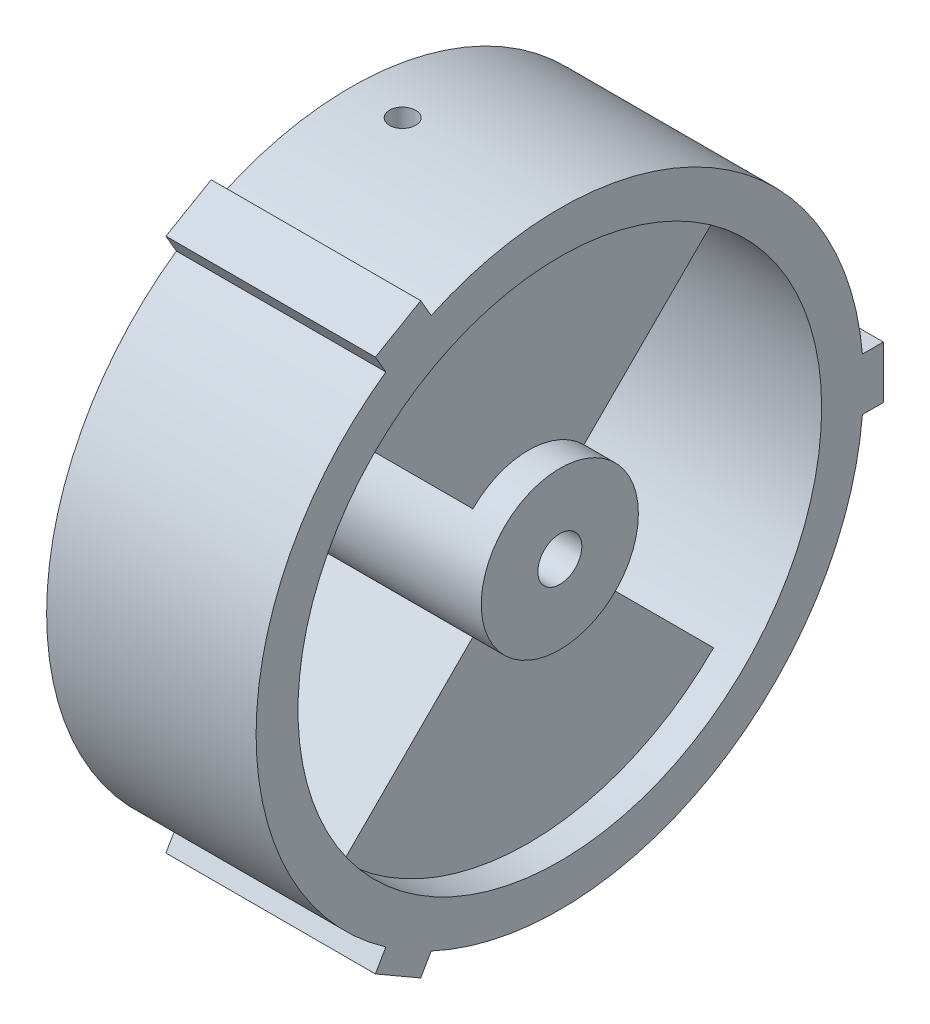
from build123d import *

# Parameters (mm, degrees)
CROQUIS2_R              = 25
CROQUIS2_R_2            = 7.5
CORTAR_EXTRUIR1_DEPTH   = 3
CORTAR_EXTRUIR3_DEPTH   = 73
CROQUIS4_R              = 1.25
CORTAR_EXTRUIR4_DEPTH   = 20
CROQUIS5_R              = 1
CORTAR_EXTRUIR5_DEPTH   = 10
CORTAR_EXTRUIR6_START   = -1
CROQUIS6_R              = 24
CROQUIS6_R_2            = 7.5
CORTAR_EXTRUIR6_DEPTH   = 1
SALIENTE_EXTRUIR1_START = -20
SALIENTE_EXTRUIR1_DEPTH = 20
MATRIZC1_COUNT          = 3


with BuildPart() as part:
    # Croquis1 → Revolución1 (revolve)
    with BuildSketch(Plane.XY, mode=Mode.PRIVATE) as revoluci_n1_sk:
        Polygon((-10, 29), (-10, 2.1), (0, 2.1), (10, 2.1), (10, 29), align=None)
    revolve(revoluci_n1_sk.sketch.rotate(Axis((0, 0, 0), (1, 0, 0)), 90), axis=Axis((0, 0, 0), (1, 0, 0)))

    # Croquis2 → Cortar-Extruir1 (cut)
    with BuildSketch(Plane(origin=(10, 0, 0), x_dir=(0, 0, -1), z_dir=(1, 0, 0))):
        Circle(CROQUIS2_R)
        Circle(CROQUIS2_R_2, mode=Mode.SUBTRACT)
    extrude(amount=-CORTAR_EXTRUIR1_DEPTH, mode=Mode.SUBTRACT)

    # Croquis3 → Cortar-Extruir3 (cut)
    with BuildSketch(Plane(origin=(10, 0, 0), x_dir=(0, 0, -1), z_dir=(1, 0, 0))):
        with BuildLine():
            ThreePointArc((-5.303301, -5.303301), (-7.5, 0), (-5.303301, 5.303301))
            Line((-5.303301, 5.303301), (-17.67767, 17.67767))
            ThreePointArc((-17.67767, 17.67767), (-25, 0), (-17.67767, -17.67767))
            Line((-17.67767, -17.67767), (-5.303301, -5.303301))
        make_face()
        with BuildLine():
            ThreePointArc((17.67767, -17.67767), (25, 0), (17.67767, 17.67767))
            Line((17.67767, 17.67767), (5.303301, 5.303301))
            ThreePointArc((5.303301, 5.303301), (7.5, 0), (5.303301, -5.303301))
            Line((5.303301, -5.303301), (17.67767, -17.67767))
        make_face()
    extrude(amount=-CORTAR_EXTRUIR3_DEPTH, mode=Mode.SUBTRACT)

    # Croquis4 → Cortar-Extruir4 (cut)
    with BuildSketch(Plane(origin=(0, 30, 0), x_dir=(1, 0, 0), z_dir=(0, 1, 0))):
        with Locations(Location((-5, 0, 0), (0, 0, 270))):
            Circle(CROQUIS4_R)
    extrude(amount=-CORTAR_EXTRUIR4_DEPTH, mode=Mode.SUBTRACT)

    # Croquis5 → Cortar-Extruir5 (cut)
    with BuildSketch(Plane(origin=(0, 10, 0), x_dir=(1, 0, 0), z_dir=(0, 1, 0))):
        with Locations(Location((-5, 0, 0), (0, 0, 270))):
            Circle(CROQUIS5_R)
    extrude(amount=-CORTAR_EXTRUIR5_DEPTH, mode=Mode.SUBTRACT)

    # Croquis6 → Cortar-Extruir6 (cut)
    with BuildSketch(Plane.ZY.offset(10).offset(CORTAR_EXTRUIR6_START)):
        Circle(CROQUIS6_R)
        with Locations(Location((0, 0, 0), (0, 0, 180))):
            Circle(CROQUIS6_R_2, mode=Mode.SUBTRACT)
    extrude(amount=CORTAR_EXTRUIR6_DEPTH, mode=Mode.SUBTRACT)

    # Croquis7 → Saliente-Extruir1 (add)
    with BuildSketch(Plane(origin=(10, 0, 0), x_dir=(0, 0, -1), z_dir=(1, 0, 0)).offset(SALIENTE_EXTRUIR1_START)):
        with BuildLine():
            Line((29, -2.5), (29, 0))
            ThreePointArc((29, 0), (28.972998, -1.251165), (28.89204, -2.5))
            Line((28.89204, -2.5), (29, -2.5))
        make_face()
        Polygon((30.89204, 2.5), (29, 2.5), (29, 0), (29, -2.5), (30.89204, -2.5), align=None)
        with BuildLine():
            Line((29, 0), (29, 2.5))
            Line((29, 2.5), (28.89204, 2.5))
            ThreePointArc((28.89204, 2.5), (28.972998, 1.251165), (29, 0))
        make_face()
    saliente_extruir1 = extrude(amount=SALIENTE_EXTRUIR1_DEPTH)

    # MatrizC1: Saliente-Extruir1 ×3 about axis
    matrizc1_axis = Axis((0, 0, 0), (1, 0, 0))
    for i in range(1, MATRIZC1_COUNT):
        add(saliente_extruir1.rotate(matrizc1_axis, i * 360 / MATRIZC1_COUNT))


solid = part.part
